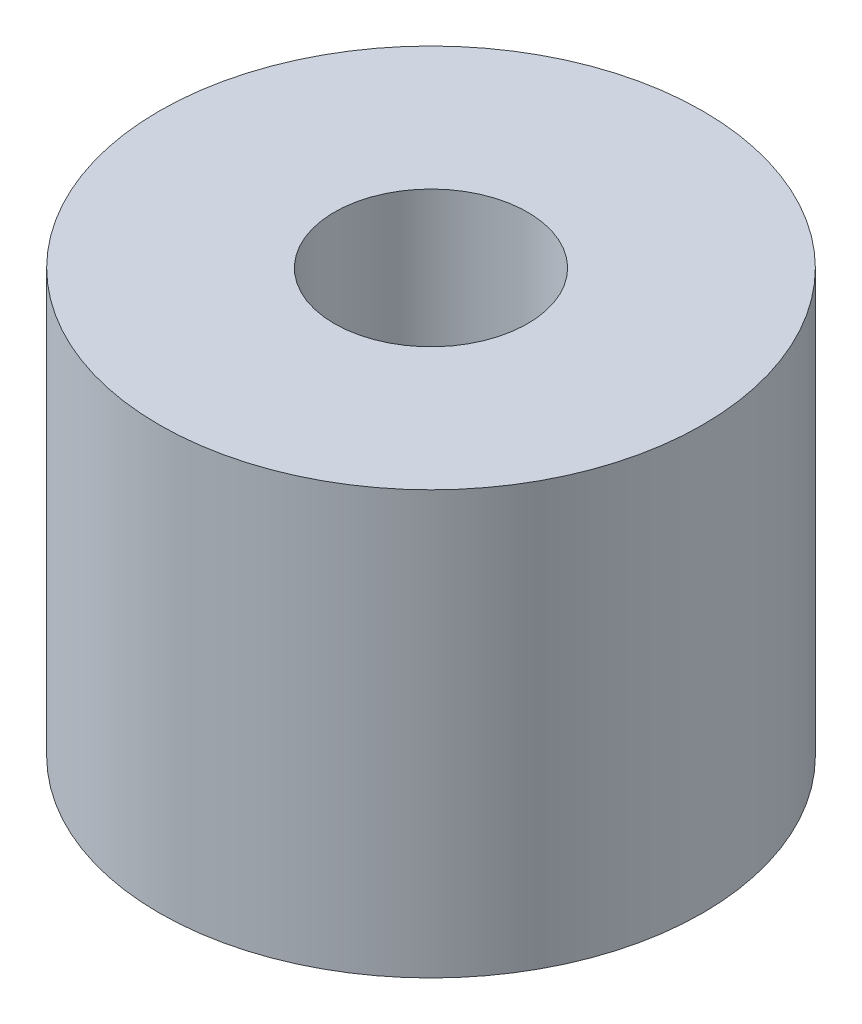
from build123d import *

# Parameters (mm, degrees)
SKETCH1_R           = 4.5
SKETCH1_R_2         = 1.6
BOSS_EXTRUDE1_DEPTH = 7


with BuildPart() as part:
    # Sketch1 → Boss-Extrude1 (new body)
    with BuildSketch(Plane(origin=(0, 0, 0), x_dir=(1, 0, 0), z_dir=(0, 1, 0))):
        with Locations(Location((0, 0, 0), (0, 0, 270))):
            Circle(SKETCH1_R)
        with Locations(Location((0, 0, 0), (0, 0, 270))):
            Circle(SKETCH1_R_2, mode=Mode.SUBTRACT)
    extrude(amount=BOSS_EXTRUDE1_DEPTH)


solid = part.part
